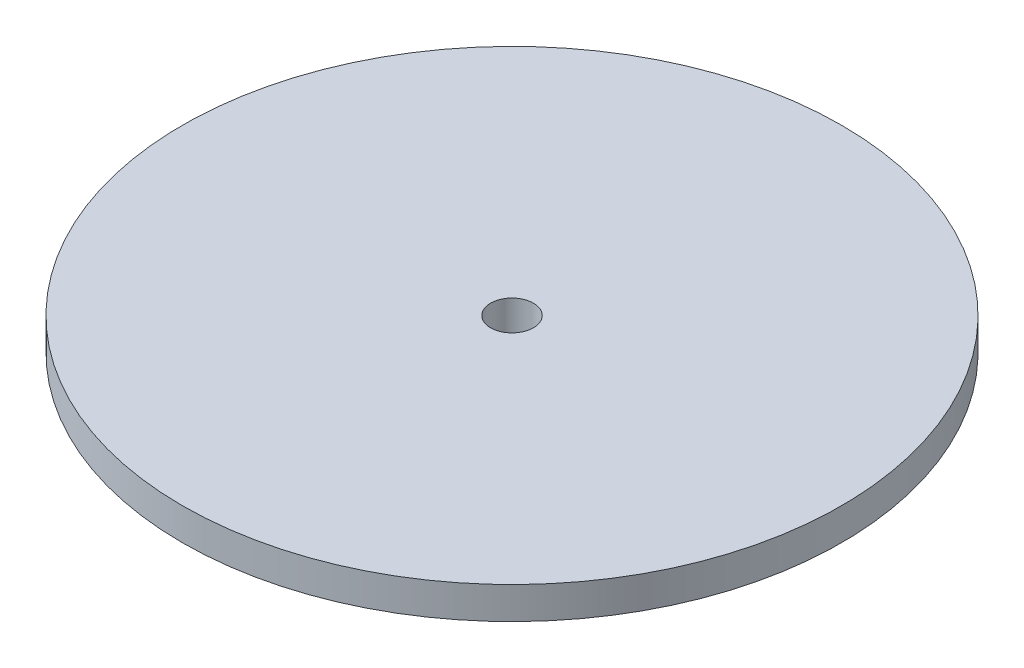
from build123d import *

# Parameters (mm, degrees)
SKETCH1_R           = 30.8
SKETCH1_R_2         = 2
BOSS_EXTRUDE1_DEPTH = 3


with BuildPart() as part:
    # Sketch1 → Boss-Extrude1 (new body)
    with BuildSketch(Plane(origin=(0, 0, 0), x_dir=(1, 0, 0), z_dir=(0, 1, 0))):
        with Locations(Location((0, 0, 0), (0, 0, 270))):
            Circle(SKETCH1_R)
        with Locations(Location((0, 0, 0), (0, 0, 270))):
            Circle(SKETCH1_R_2, mode=Mode.SUBTRACT)
    extrude(amount=BOSS_EXTRUDE1_DEPTH)


solid = part.part
